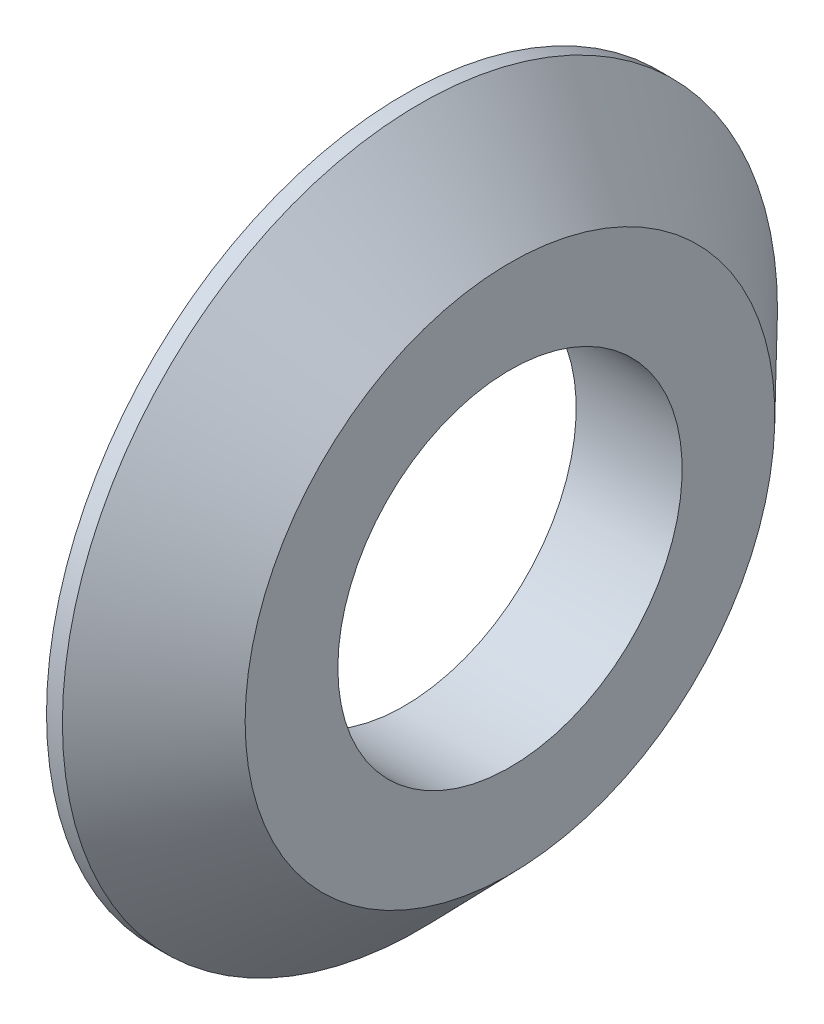
from build123d import *


with BuildPart() as part:
    # Sketch1 → Revolve1 (revolve)
    with BuildSketch(Plane(origin=(0, 0, 0), x_dir=(1, 0, 0), z_dir=(0, 1, 0)), mode=Mode.PRIVATE) as revolve1_sk:
        Polygon((-1, 3.25), (1, 3.25), (1, 5), (-0.7, 6.75), (-1, 6.75), align=None)
    revolve(revolve1_sk.sketch.rotate(Axis((-6.255136986, 0, 0), (1, 0, 0)), 180), axis=Axis((-6.255136986, 0, 0), (1, 0, 0)))


solid = part.part
